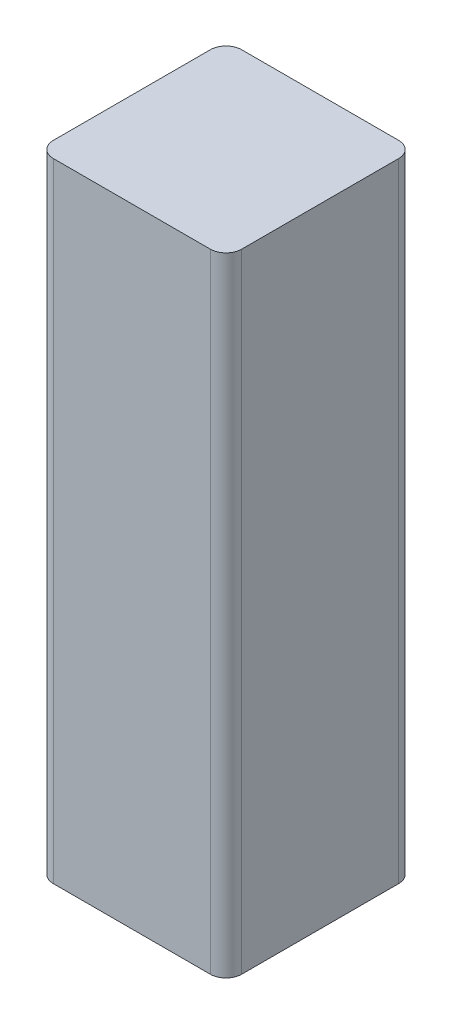
from build123d import *

# Parameters (mm, degrees)
CORPO_DEPTH = 20


with BuildPart() as part:
    # Sketch1 → Corpo (new body)
    with BuildSketch(Plane(origin=(0, 0, 0), x_dir=(1, 0, 0), z_dir=(0, 1, 0))):
        with BuildLine():
            Line((-2.5, -3), (2.5, -3))
            ThreePointArc((2.5, -3), (2.853553391, -2.853553391), (3, -2.5))
            Line((3, -2.5), (3, 2.5))
            ThreePointArc((3, 2.5), (2.853553391, 2.853553391), (2.5, 3))
            Line((2.5, 3), (-2.5, 3))
            ThreePointArc((-2.5, 3), (-2.853553391, 2.853553391), (-3, 2.5))
            Line((-3, 2.5), (-3, -2.5))
            ThreePointArc((-3, -2.5), (-2.853553391, -2.853553391), (-2.5, -3))
        make_face()
    extrude(amount=CORPO_DEPTH)


solid = part.part
